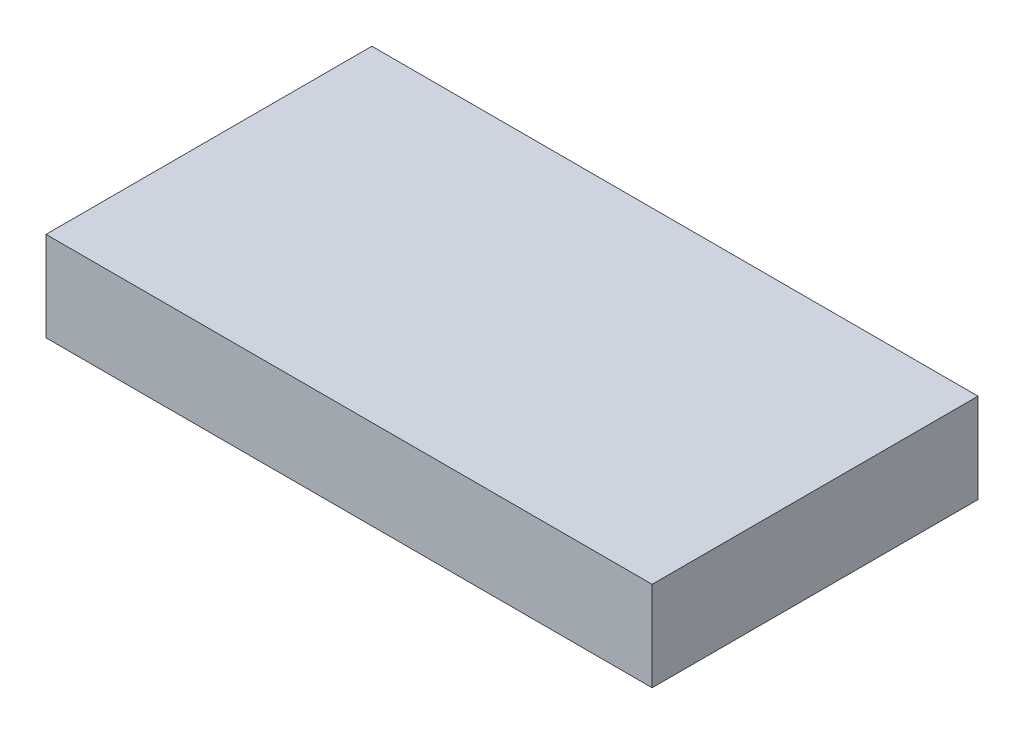
from build123d import *

# Parameters (mm, degrees)
SKETCH1_W           = 37.2
SKETCH1_H           = 20
BOSS_EXTRUDE1_DEPTH = 5.5


with BuildPart() as part:
    # Sketch1 → Boss-Extrude1 (new body)
    with BuildSketch(Plane(origin=(0, 0, 0), x_dir=(1, 0, 0), z_dir=(0, 1, 0))):
        with Locations((18.6, 10)):
            Rectangle(SKETCH1_W, SKETCH1_H)
    extrude(amount=BOSS_EXTRUDE1_DEPTH)


solid = part.part
